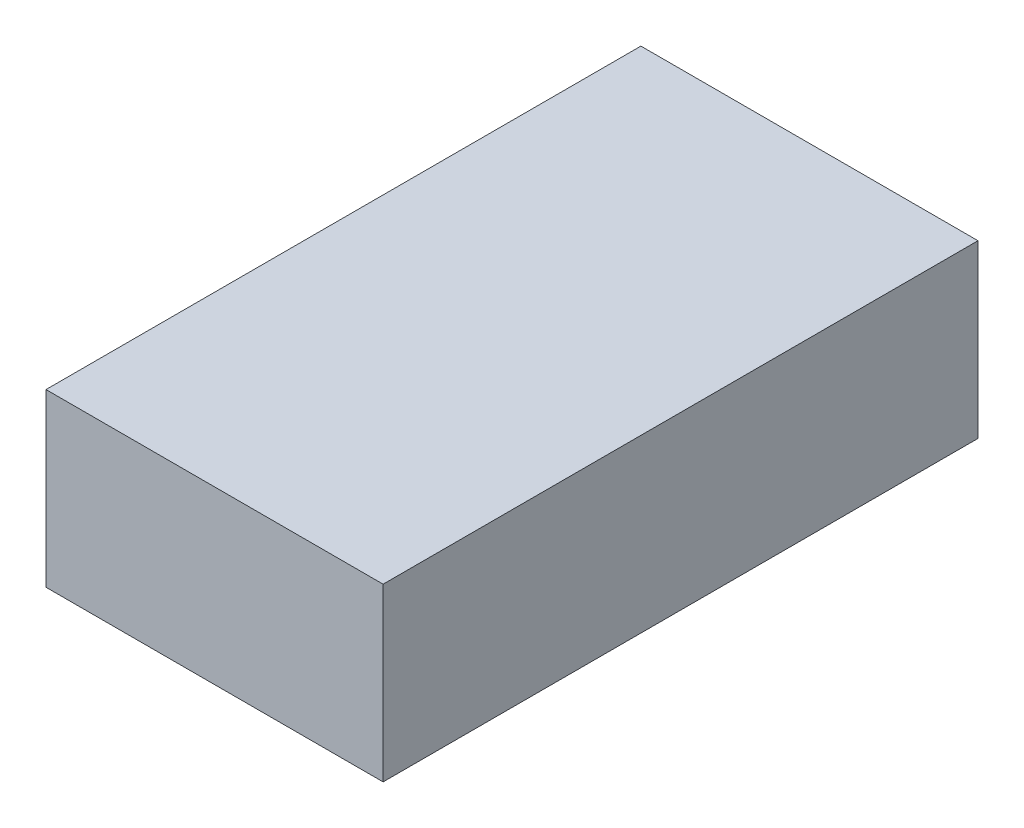
from build123d import *

# Parameters (mm, degrees)
SKETCH1_W           = 85
SKETCH1_H           = 150
BOSS_EXTRUDE1_DEPTH = 43.18


with BuildPart() as part:
    # Sketch1 → Boss-Extrude1 (new body)
    with BuildSketch(Plane(origin=(0, 0, 0), x_dir=(1, 0, 0), z_dir=(0, 1, 0))):
        Rectangle(SKETCH1_W, SKETCH1_H)
    extrude(amount=BOSS_EXTRUDE1_DEPTH)


solid = part.part
